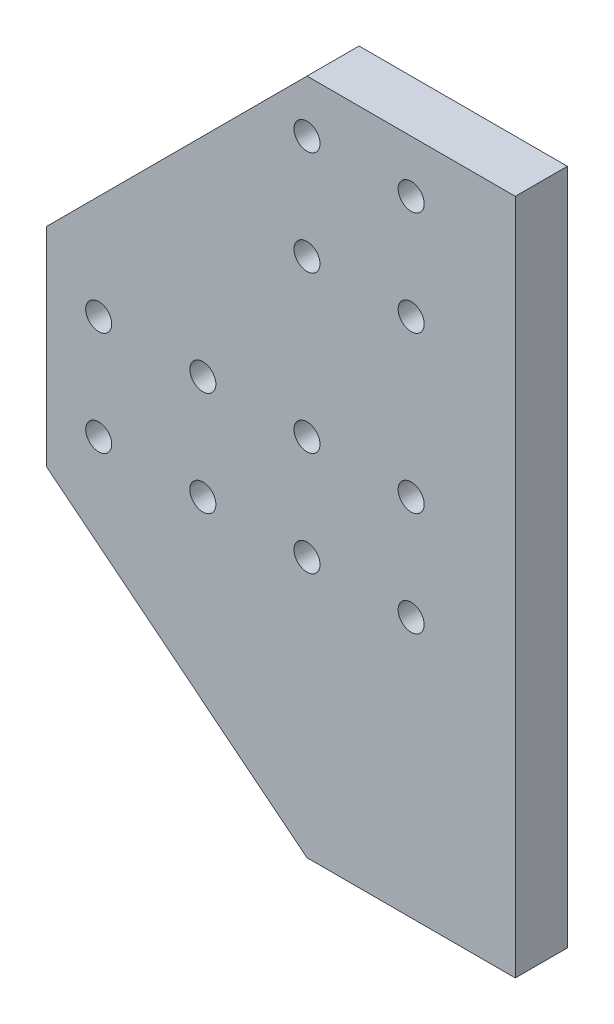
from build123d import *

# Parameters (mm, degrees)
BOSS_EXTRUDE1_DEPTH = 10
SKETCH2_R           = 2.5
CUT_EXTRUDE1_DEPTH  = 10


with BuildPart() as part:
    # Sketch1 → Boss-Extrude1 (new body)
    with BuildSketch(Plane.XY):
        Polygon((0, 0), (40, 0), (40, 130), (0, 130), (-50, 80), (-50, 40), align=None)
    extrude(amount=BOSS_EXTRUDE1_DEPTH)

    # Sketch2 → Cut-Extrude1 (cut)
    with BuildSketch(Plane.XY.offset(10)):
        with Locations((0, 120)):
            Circle(SKETCH2_R)
        with Locations((20, 120)):
            Circle(SKETCH2_R)
        with Locations((0, 100)):
            Circle(SKETCH2_R)
        with Locations((20, 100)):
            Circle(SKETCH2_R)
        with Locations((-40, 70)):
            Circle(SKETCH2_R)
        with Locations((-20, 70)):
            Circle(SKETCH2_R)
        with Locations((-40, 50)):
            Circle(SKETCH2_R)
        with Locations((-20, 50)):
            Circle(SKETCH2_R)
        with Locations((0, 70)):
            Circle(SKETCH2_R)
        with Locations((20, 70)):
            Circle(SKETCH2_R)
        with Locations((0, 50)):
            Circle(SKETCH2_R)
        with Locations((20, 50)):
            Circle(SKETCH2_R)
    extrude(amount=-CUT_EXTRUDE1_DEPTH, mode=Mode.SUBTRACT)


solid = part.part
